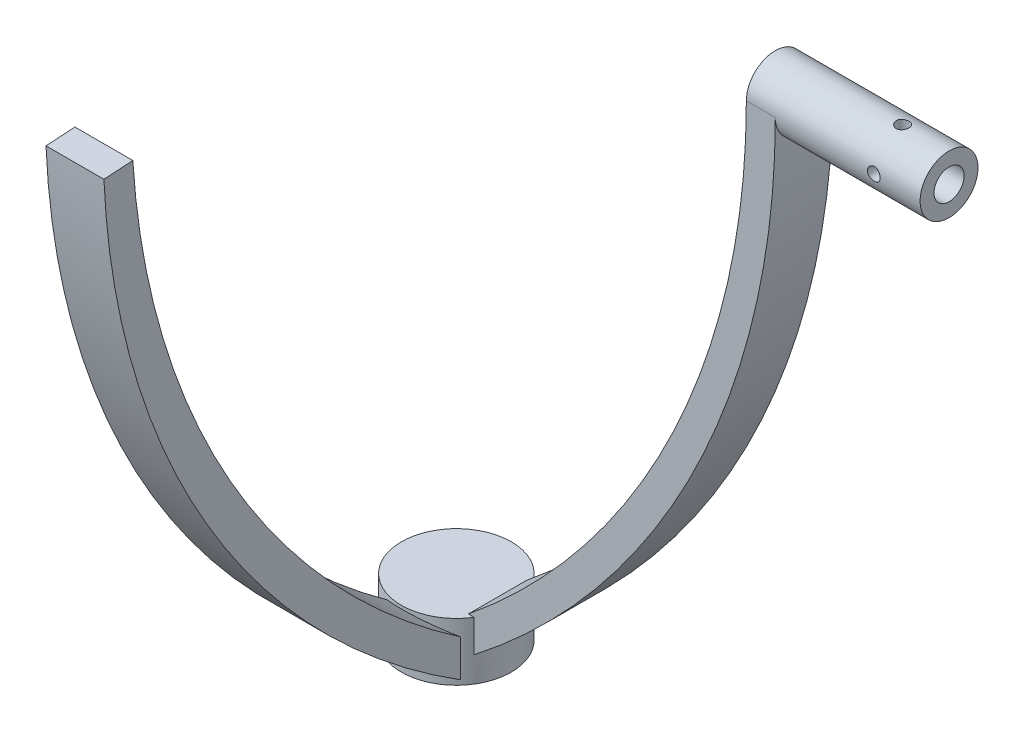
from build123d import *

# Parameters (mm, degrees)
SKETCH1_R                = 5
BOSS_EXTRUDE1_DEPTH      = 25
SKETCH2_R                = 2.6
CUT_EXTRUDE1_DEPTH       = 25
CUT_EXTRUDE3_DEPTH       = 25
CUT_EXTRUDE3_DEPTH_BACK  = 25
SKETCH3_R                = 1.1
CUT_EXTRUDE4_DEPTH       = 25
CUT_EXTRUDE4_DEPTH_BACK  = 25
SKETCH4_R                = 1.1
BOSS_EXTRUDE2_DEPTH      = 5
BOSS_EXTRUDE2_DEPTH_BACK = 5
BOSS_EXTRUDE3_START      = 5
SKETCH6_R                = 5
BOSS_EXTRUDE3_DEPTH      = 5
BOSS_EXTRUDE4_DEPTH      = 5
BOSS_EXTRUDE4_DEPTH_BACK = 5
SKETCH8_R                = 9.5
BOSS_EXTRUDE10_DEPTH     = 10


with BuildPart() as part:
    # Sketch1 → Boss-Extrude1 (new body)
    with BuildSketch(Plane(origin=(0, 0, 0), x_dir=(0, 0, -1), z_dir=(1, 0, 0))):
        Circle(SKETCH1_R)
    extrude(amount=BOSS_EXTRUDE1_DEPTH)

    # Sketch2 → Cut-Extrude1 (cut)
    with BuildSketch(Plane.ZY):
        Circle(SKETCH2_R)
    extrude(amount=-CUT_EXTRUDE1_DEPTH, mode=Mode.SUBTRACT)

    # Sketch3 → Cut-Extrude3 (cut, two sides: drawn at the far end of the back side and taken through both)
    with BuildSketch(Plane(origin=(0, 0, 0), x_dir=(1, 0, 0), z_dir=(0, 1, 0)).offset(-CUT_EXTRUDE3_DEPTH_BACK)):
        with Locations((17, 0)):
            Circle(SKETCH3_R)
    extrude(amount=CUT_EXTRUDE3_DEPTH + CUT_EXTRUDE3_DEPTH_BACK, mode=Mode.SUBTRACT)

    # Sketch4 → Cut-Extrude4 (cut, two sides: drawn at the far end of the back side and taken through both)
    with BuildSketch(Plane.XY.offset(-CUT_EXTRUDE4_DEPTH_BACK)):
        with Locations((17, 0)):
            Circle(SKETCH4_R)
    extrude(amount=CUT_EXTRUDE4_DEPTH + CUT_EXTRUDE4_DEPTH_BACK, mode=Mode.SUBTRACT)



with BuildPart() as body_2:
    # Sketch5 → Boss-Extrude2 (new, two sides: drawn at the far end of the back side and taken through both)
    with BuildSketch(Plane.XY.offset(-BOSS_EXTRUDE2_DEPTH_BACK)):
        with BuildLine():
            Line((0, 0), (-5, 0))
            ThreePointArc((-5, 0), (-21.603552953, -63.499136863), (-67.164047662, -110.743815663))
            Line((-67.164047662, -110.743815663), (-58, -110.743815663))
            ThreePointArc((-58, -110.743815663), (-15.377599409, -62.506385089), (0, 0))
        make_face()
    extrude(amount=BOSS_EXTRUDE2_DEPTH + BOSS_EXTRUDE2_DEPTH_BACK)


with BuildPart() as part_1:
    add(part.part)

    add(body_2.part)  # Boss-Extrude3 merges body 2
    # Sketch6 → Boss-Extrude3 (add)
    with BuildSketch(Plane.ZY.offset(BOSS_EXTRUDE3_START)):
        Circle(SKETCH6_R)
    extrude(amount=-BOSS_EXTRUDE3_DEPTH)

    # Sketch7 → Boss-Extrude4 (add, two sides: drawn at the far end of the back side and taken through both)
    with BuildSketch(Plane(origin=(-58, -130.891746243, -8.226376206), x_dir=(0, 0.0627249424806172, -0.998030852023525), z_dir=(1, 0, 0)).offset(-BOSS_EXTRUDE4_DEPTH_BACK)):
        with BuildLine():
            Line((-68.071017976, 131.15), (-63.071017976, 131.15))
            ThreePointArc((-63.071017976, 131.15), (-46.774831734, 68.001453515), (-1.956245207, 20.624255297))
            Line((-1.956245207, 20.624255297), (-11.936553728, 20.93788001))
            ThreePointArc((-11.936553728, 20.93788001), (-53.801421124, 69.016374761), (-68.071017976, 131.15))
        make_face()
    extrude(amount=BOSS_EXTRUDE4_DEPTH + BOSS_EXTRUDE4_DEPTH_BACK)

    # Sketch8 → Boss-Extrude10 (add)
    with BuildSketch(Plane.XZ.offset(110.743815663)):
        with Locations((-60.082023831, 0)):
            Circle(SKETCH8_R)
    extrude(amount=-BOSS_EXTRUDE10_DEPTH)


solid = part_1.part
